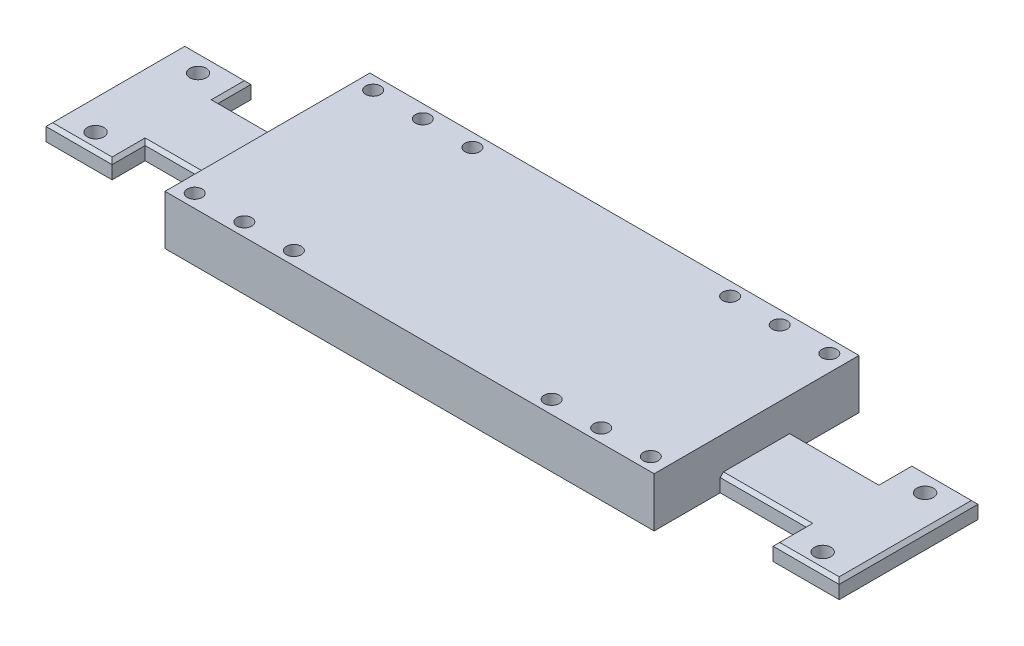
from build123d import *

# Parameters (mm, degrees)
SKETCH1_W           = 148
SKETCH1_H           = 62
BOSS_EXTRUDE1_DEPTH = 15
SKETCH2_R           = 2.25
CUT_EXTRUDE1_DEPTH  = 35
SKETCH3_R           = 2.25
CUT_EXTRUDE2_DEPTH  = 25
SKETCH4_W           = 22
SKETCH4_H           = 5
BOSS_EXTRUDE2_DEPTH = 26
SKETCH5_W           = 22
SKETCH5_H           = 5
BOSS_EXTRUDE3_DEPTH = 26
SKETCH6_W           = 20
SKETCH6_H           = 42
BOSS_EXTRUDE4_DEPTH = 15
SKETCH7_W           = 20
SKETCH7_H           = 42
BOSS_EXTRUDE5_DEPTH = 15
SKETCH8_R           = 2.5
CUT_EXTRUDE3_DEPTH  = 25
SKETCH9_R           = 2.5
CUT_EXTRUDE4_DEPTH  = 25
CHAMFER3_SIZE       = 1
CHAMFER4_SIZE       = 1
CHAMFER5_SIZE       = 1
SKETCH10_W          = 27.530750263
SKETCH10_H          = 14.173658936
CUT_EXTRUDE5_DEPTH  = 60
SKETCH11_W          = 32.495188708
SKETCH11_H          = 15.919959855
CUT_EXTRUDE6_DEPTH  = 60
CHAMFER6_SIZE       = 1
CHAMFER7_SIZE       = 1


with BuildPart() as part:
    # Sketch1 → Boss-Extrude1 (new body)
    with BuildSketch(Plane(origin=(0, 0, 0), x_dir=(1, 0, 0), z_dir=(0, 1, 0))):
        with Locations((74, 31)):
            Rectangle(SKETCH1_W, SKETCH1_H)
    extrude(amount=BOSS_EXTRUDE1_DEPTH)

    # Sketch2 → Cut-Extrude1 (cut)
    with BuildSketch(Plane(origin=(0, 15, 0), x_dir=(1, 0, 0), z_dir=(0, 1, 0))):
        with Locations(Location((5, 4, 0), (0, 0, 270))):
            Circle(SKETCH2_R)
        with Locations(Location((20, 4, 0), (0, 0, 270))):
            Circle(SKETCH2_R)
        with Locations(Location((35, 4, 0), (0, 0, 270))):
            Circle(SKETCH2_R)
        with Locations(Location((5, 58, 0), (0, 0, 270))):
            Circle(SKETCH2_R)
        with Locations(Location((20, 58, 0), (0, 0, 270))):
            Circle(SKETCH2_R)
        with Locations(Location((35, 58, 0), (0, 0, 270))):
            Circle(SKETCH2_R)
    extrude(amount=-CUT_EXTRUDE1_DEPTH, mode=Mode.SUBTRACT)

    # Sketch3 → Cut-Extrude2 (cut)
    with BuildSketch(Plane(origin=(0, 15, 0), x_dir=(1, 0, 0), z_dir=(0, 1, 0))):
        with Locations(Location((143, 58, 0), (0, 0, 270))):
            Circle(SKETCH3_R)
        with Locations(Location((143, 4, 0), (0, 0, 270))):
            Circle(SKETCH3_R)
        with Locations(Location((128, 58, 0), (0, 0, 270))):
            Circle(SKETCH3_R)
        with Locations(Location((113, 58, 0), (0, 0, 270))):
            Circle(SKETCH3_R)
        with Locations(Location((128, 4, 0), (0, 0, 270))):
            Circle(SKETCH3_R)
        with Locations(Location((113, 4, 0), (0, 0, 270))):
            Circle(SKETCH3_R)
    extrude(amount=-CUT_EXTRUDE2_DEPTH, mode=Mode.SUBTRACT)

    # Sketch4 → Boss-Extrude2 (add)
    with BuildSketch(Plane(origin=(148, 0, 0), x_dir=(0, 0, -1), z_dir=(1, 0, 0))):
        with Locations((31, 2.5)):
            Rectangle(SKETCH4_W, SKETCH4_H)
    extrude(amount=BOSS_EXTRUDE2_DEPTH)

    # Sketch5 → Boss-Extrude3 (add)
    with BuildSketch(Plane.ZY):
        with Locations((-31, 2.5)):
            Rectangle(SKETCH5_W, SKETCH5_H)
    extrude(amount=BOSS_EXTRUDE3_DEPTH)

    # Sketch6 → Boss-Extrude4 (add)
    with BuildSketch(Plane(origin=(0, 15, 0), x_dir=(1, 0, 0), z_dir=(0, 1, 0))):
        with Locations((184, 31)):
            Rectangle(SKETCH6_W, SKETCH6_H)
    extrude(amount=-BOSS_EXTRUDE4_DEPTH)

    # Sketch7 → Boss-Extrude5 (add)
    with BuildSketch(Plane(origin=(0, 15, 0), x_dir=(1, 0, 0), z_dir=(0, 1, 0))):
        with Locations((-36, 31)):
            Rectangle(SKETCH7_W, SKETCH7_H)
    extrude(amount=-BOSS_EXTRUDE5_DEPTH)

    # Sketch8 → Cut-Extrude3 (cut)
    with BuildSketch(Plane(origin=(0, 15, 0), x_dir=(1, 0, 0), z_dir=(0, 1, 0))):
        with Locations(Location((-36, 46, 0), (0, 0, 270))):
            Circle(SKETCH8_R)
        with Locations(Location((-36, 15, 0), (0, 0, 270))):
            Circle(SKETCH8_R)
    extrude(amount=-CUT_EXTRUDE3_DEPTH, mode=Mode.SUBTRACT)

    # Sketch9 → Cut-Extrude4 (cut)
    with BuildSketch(Plane(origin=(0, 15, 0), x_dir=(1, 0, 0), z_dir=(0, 1, 0))):
        with Locations(Location((184, 46, 0), (0, 0, 270))):
            Circle(SKETCH9_R)
        with Locations(Location((184, 15, 0), (0, 0, 270))):
            Circle(SKETCH9_R)
    extrude(amount=-CUT_EXTRUDE4_DEPTH, mode=Mode.SUBTRACT)

    # Chamfer3
    chamfer3_edges = [part.edges().sort_by_distance(p)[0] for p in [
        (194, 15, -31),
        (-26, 15, -31),
        (-46, 15, -31),
        (161, 5, -20),
    ]]
    chamfer(chamfer3_edges, length=CHAMFER3_SIZE)

    # Chamfer4
    chamfer4_edges = [part.edges().sort_by_distance(p)[0] for p in [
        (-13, 5, -20),
        (-36, 15, -10),
        (-36, 15, -52),
        (183.5, 15, -10),
        (183.5, 15, -52),
        (161, 5, -42),
    ]]
    chamfer(chamfer4_edges, length=CHAMFER4_SIZE)

    # Chamfer5
    chamfer5_edges = [part.edges().sort_by_distance(p)[0] for p in [
        (-13, 5, -42),
        (174, 15, -31),
    ]]
    chamfer(chamfer5_edges, length=CHAMFER5_SIZE)

    # Sketch10 → Cut-Extrude5 (cut)
    with BuildSketch(Plane(origin=(0, 0, -52), x_dir=(-1, 0, 0), z_dir=(0, 0, -1))):
        with Locations((-183.765375132, 12.086829468)):
            Rectangle(SKETCH10_W, SKETCH10_H)
    extrude(amount=-CUT_EXTRUDE5_DEPTH, mode=Mode.SUBTRACT)

    # Sketch11 → Cut-Extrude6 (cut)
    with BuildSketch(Plane(origin=(0, 0, -52), x_dir=(-1, 0, 0), z_dir=(0, 0, -1))):
        with Locations((37.724079719, 12.959979928)):
            Rectangle(SKETCH11_W, SKETCH11_H)
    extrude(amount=-CUT_EXTRUDE6_DEPTH, mode=Mode.SUBTRACT)

    # Chamfer6
    chamfer6_edges = [part.edges().sort_by_distance(p)[0] for p in [
        (174, 5, -46.5),
        (194, 5, -31),
        (174, 5, -15.5),
        (-46, 5, -31),
        (-36, 5, -10),
        (-26, 5, -46.5),
    ]]
    chamfer(chamfer6_edges, length=CHAMFER6_SIZE)

    # Chamfer7
    chamfer7_edges = [part.edges().sort_by_distance(p)[0] for p in [
        (-36, 5, -52),
        (-26, 5, -16),
        (184, 5, -10),
        (184, 5, -52),
    ]]
    chamfer(chamfer7_edges, length=CHAMFER7_SIZE)


solid = part.part
